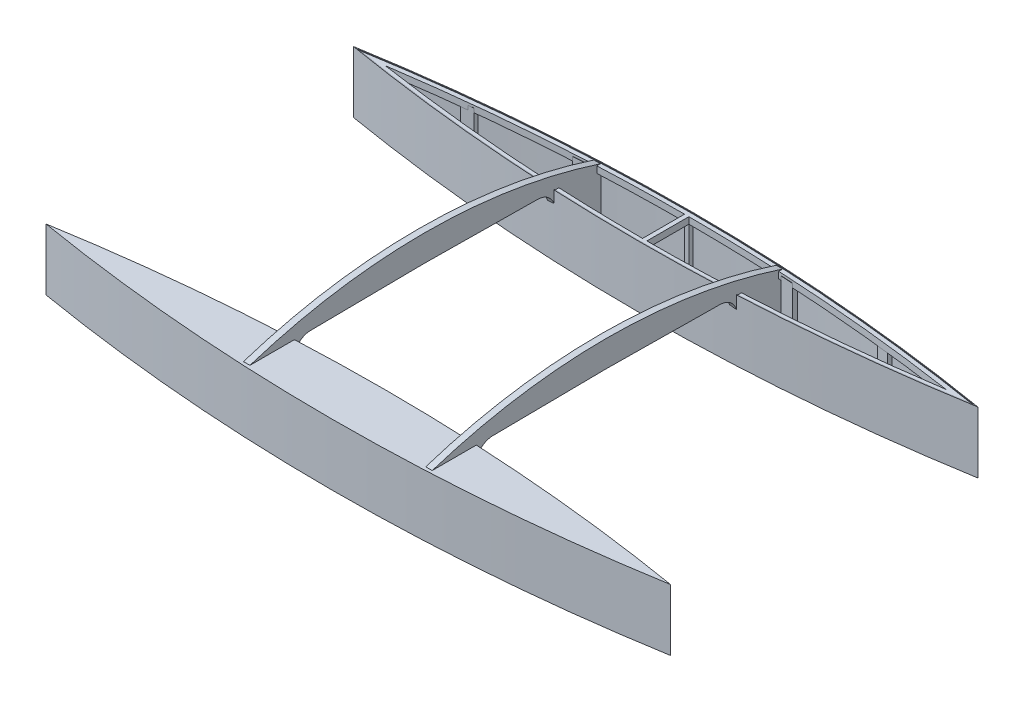
from build123d import *

# Parameters (mm, degrees)
BOSS_EXTRUDE1_DEPTH    = 180
SHELL4_T               = -2
BOSS_EXTRUDE2_DEPTH    = 19.05
BOSS_EXTRUDE7_DEPTH    = 150
BOSS_EXTRUDE7_2_DEPTH  = 150
BOSS_EXTRUDE7_3_DEPTH  = 150
BOSS_EXTRUDE7_4_DEPTH  = 150
BOSS_EXTRUDE7_5_DEPTH  = 150
SKETCH5_W              = 12.7
SKETCH5_H              = 12.700008415
BOSS_EXTRUDE7_6_DEPTH  = 150
BOSS_EXTRUDE7_7_DEPTH  = 150
BOSS_EXTRUDE7_8_DEPTH  = 150
BOSS_EXTRUDE7_9_DEPTH  = 150
BOSS_EXTRUDE7_10_DEPTH = 150
BOSS_EXTRUDE7_11_DEPTH = 150
BOSS_EXTRUDE7_12_DEPTH = 150
BOSS_EXTRUDE8_DEPTH    = 19.05


with BuildPart() as part:
    # Sketch1 → Boss-Extrude1 (new body)
    with BuildSketch(Plane(origin=(0, 0, 0), x_dir=(1, 0, 0), z_dir=(0, 1, 0))):
        with BuildLine():
            ThreePointArc((-914.4, 0), (0, 76.2), (914.4, 0))
            ThreePointArc((914.4, 0), (0, -76.200000855), (-914.4, 0))
        make_face()
    boss_extrude1 = extrude(amount=BOSS_EXTRUDE1_DEPTH)

    # Shell4
    shell4_openings = [part.faces().sort_by_distance(p)[0] for p in [
        (0, 180, 3.43e-07),
    ]]
    offset(amount=SHELL4_T, openings=shell4_openings)

    # Sketch4 → Boss-Extrude2 (add)
    with BuildSketch(Plane(origin=(0, 2, 0), x_dir=(1, 0, 0), z_dir=(0, 1, 0))):
        with BuildLine():
            ThreePointArc((-902.23797311, -1.1e-08), (0, -74.200000855), (902.23797311, -1.1e-08))
            ThreePointArc((902.23797311, -1.1e-08), (0, 74.2), (-902.23797311, -1.1e-08))
        make_face()
        with BuildLine():
            ThreePointArc((-820.928225181, -8.2e-08), (-414.780382192, 45.86538471), (-6.35, 61.496340837))
            Line((-6.35, 61.496340837), (-6.35, -61.496341692))
            ThreePointArc((-6.35, -61.496341692), (-414.780382217, -45.865385389), (-820.928225181, -8.2e-08))
        make_face(mode=Mode.SUBTRACT)
        with BuildLine():
            Line((6.35, -61.496341692), (6.35, 61.496340837))
            ThreePointArc((6.35, 61.496340837), (414.780382192, 45.86538471), (820.928225181, -8.2e-08))
            ThreePointArc((820.928225181, -8.2e-08), (414.780382217, -45.865385389), (6.35, -61.496341692))
        make_face(mode=Mode.SUBTRACT)
    boss_extrude2 = extrude(amount=BOSS_EXTRUDE2_DEPTH)

    # Mirror1: Boss-Extrude2 across plane
    add(boss_extrude2.mirror(Plane.ZX.offset(90)))

    # Sketch9 → Boss-Extrude8 (add)
    with BuildSketch(Plane.ZY.offset(276.35)):
        with BuildLine():
            Line((117.454477565, 179.642208922), (450.043064057, 183.303128562))
            Line((450.043064057, 183.303128562), (782.631650549, 179.642208922))
            ThreePointArc((782.631650549, 179.642208922), (818.190680136, 164.568077951), (832.87251094, 128.845286152))
            Line((832.87251094, 128.845286152), (832.87251094, 0))
            Line((832.87251094, 0), (967.420778825, 0))
            Line((967.420778825, 0), (967.420778825, 177.608169943))
            ThreePointArc((967.420778825, 177.608169943), (450.043064057, 260.360149015), (-67.33465071, 177.608169943))
            Line((-67.33465071, 177.608169943), (-67.33465071, 0))
            Line((-67.33465071, 0), (67.213617174, 0))
            Line((67.213617174, 0), (67.213617174, 128.845286152))
            ThreePointArc((67.213617174, 128.845286152), (81.895447978, 164.568077951), (117.454477565, 179.642208922))
        make_face()
    boss_extrude8 = extrude(amount=-BOSS_EXTRUDE8_DEPTH)

    # Mirror2: Boss-Extrude8 across plane
    add(boss_extrude8.mirror(Plane(origin=(0, 0, 0), x_dir=(0, 0, 1), z_dir=(1, 0, 0))))

    # Mirror7: Boss-Extrude1 across plane
    add(boss_extrude1.mirror(Plane.XY.offset(450.043064057)))


with BuildPart() as body_2:
    # Sketch5 → Boss-Extrude7 (new body)
    with BuildSketch(Plane(origin=(0, 21.05, 0), x_dir=(1, 0, 0), z_dir=(0, 1, 0))):
        Polygon((-902.23797311, -1.1e-08), (-858.356330357, 7.085473102), (-858.356330357, -7.085473205), align=None)
    extrude(amount=BOSS_EXTRUDE7_DEPTH)


with BuildPart() as body_3:
    # Sketch5 → Boss-Extrude7 2 (new body)
    with BuildSketch(Plane(origin=(0, 21.05, 0), x_dir=(1, 0, 0), z_dir=(0, 1, 0))):
        Polygon((902.23797311, -1.1e-08), (858.356330357, -7.085473205), (858.356330357, 7.085473102), align=None)
    extrude(amount=BOSS_EXTRUDE7_2_DEPTH)


with BuildPart() as body_4:
    # Sketch5 → Boss-Extrude7 3 (new body)
    with BuildSketch(Plane(origin=(0, 21.05, 0), x_dir=(1, 0, 0), z_dir=(0, 1, 0))):
        Polygon((591.773607758, -42.4021634), (609.6, -39.54630307), (624.736564434, -37.479655913), (623.442284438, -26.114649803), (590.374680772, -29.77938755), align=None)
    extrude(amount=BOSS_EXTRUDE7_3_DEPTH)


with BuildPart() as body_5:
    # Sketch5 → Boss-Extrude7 4 (new body)
    with BuildSketch(Plane(origin=(0, 21.05, 0), x_dir=(1, 0, 0), z_dir=(0, 1, 0))):
        Polygon((-609.6, 39.54630307), (-591.831098658, 41.56258026), (-590.414924603, 29.082224285), (-626.731996566, 25.739006481), (-627.812798131, 37.479655913), align=None)
    extrude(amount=BOSS_EXTRUDE7_4_DEPTH)


with BuildPart() as body_6:
    # Sketch5 → Boss-Extrude7 5 (new body)
    with BuildSketch(Plane(origin=(0, 21.05, 0), x_dir=(1, 0, 0), z_dir=(0, 1, 0))):
        Polygon((-304.8, 65.782263623), (-282.755374568, 66.956625775), (-282.024506562, 53.237083292), (-323.942875926, 51.004006272), (-324.746326322, 64.643503569), align=None)
    extrude(amount=BOSS_EXTRUDE7_5_DEPTH)


with BuildPart() as body_7:
    # Sketch5 → Boss-Extrude7 6 (new body)
    with BuildSketch(Plane(origin=(0, 21.05, 0), x_dir=(1, 0, 0), z_dir=(0, 1, 0))):
        with Locations((0, 67.846345044)):
            Rectangle(SKETCH5_W, SKETCH5_H)
    extrude(amount=BOSS_EXTRUDE7_6_DEPTH)


with BuildPart() as body_8:
    # Sketch5 → Boss-Extrude7 7 (new body)
    with BuildSketch(Plane(origin=(0, 21.05, 0), x_dir=(1, 0, 0), z_dir=(0, 1, 0))):
        Polygon((304.8, 65.782263623), (320.761326174, 64.876799417), (319.974341591, 51.004006272), (284.540091912, 53.014142798), (285.254571408, 66.827929567), align=None)
    extrude(amount=BOSS_EXTRUDE7_7_DEPTH)


with BuildPart() as body_9:
    # Sketch5 → Boss-Extrude7 8 (new body)
    with BuildSketch(Plane(origin=(0, 21.05, 0), x_dir=(1, 0, 0), z_dir=(0, 1, 0))):
        Polygon((609.6, 39.54630307), (624.736564434, 37.479655913), (623.442284438, 26.114649803), (590.374680772, 29.77938755), (591.773607758, 42.4021634), align=None)
    extrude(amount=BOSS_EXTRUDE7_8_DEPTH)


with BuildPart() as body_10:
    # Sketch5 → Boss-Extrude7 9 (new body)
    with BuildSketch(Plane(origin=(0, 21.05, 0), x_dir=(1, 0, 0), z_dir=(0, 1, 0))):
        Polygon((285.254571408, -66.827929567), (304.8, -65.782263623), (320.761326174, -64.876799417), (319.974341591, -51.004006272), (284.540091912, -53.014142798), align=None)
    extrude(amount=BOSS_EXTRUDE7_9_DEPTH)


with BuildPart() as body_11:
    # Sketch5 → Boss-Extrude7 10 (new body)
    with BuildSketch(Plane(origin=(0, 21.05, 0), x_dir=(1, 0, 0), z_dir=(0, 1, 0))):
        with Locations((0, -67.846345044)):
            Rectangle(SKETCH5_W, SKETCH5_H)
    extrude(amount=BOSS_EXTRUDE7_10_DEPTH)


with BuildPart() as body_12:
    # Sketch5 → Boss-Extrude7 11 (new body)
    with BuildSketch(Plane(origin=(0, 21.05, 0), x_dir=(1, 0, 0), z_dir=(0, 1, 0))):
        Polygon((-324.746326322, -64.643503569), (-304.8, -65.782263623), (-282.755374568, -66.956625775), (-282.024506562, -53.237083292), (-323.942875926, -51.004006272), align=None)
    extrude(amount=BOSS_EXTRUDE7_11_DEPTH)


with BuildPart() as body_13:
    # Sketch5 → Boss-Extrude7 12 (new body)
    with BuildSketch(Plane(origin=(0, 21.05, 0), x_dir=(1, 0, 0), z_dir=(0, 1, 0))):
        Polygon((-627.812798131, -37.479655913), (-609.6, -39.54630307), (-591.831098658, -41.56258026), (-590.414924603, -29.082224285), (-626.731996566, -25.739006481), align=None)
    extrude(amount=BOSS_EXTRUDE7_12_DEPTH)


solid = Compound([part.part, body_2.part, body_3.part, body_4.part, body_5.part, body_6.part, body_7.part, body_8.part, body_9.part, body_10.part, body_11.part, body_12.part, body_13.part])
